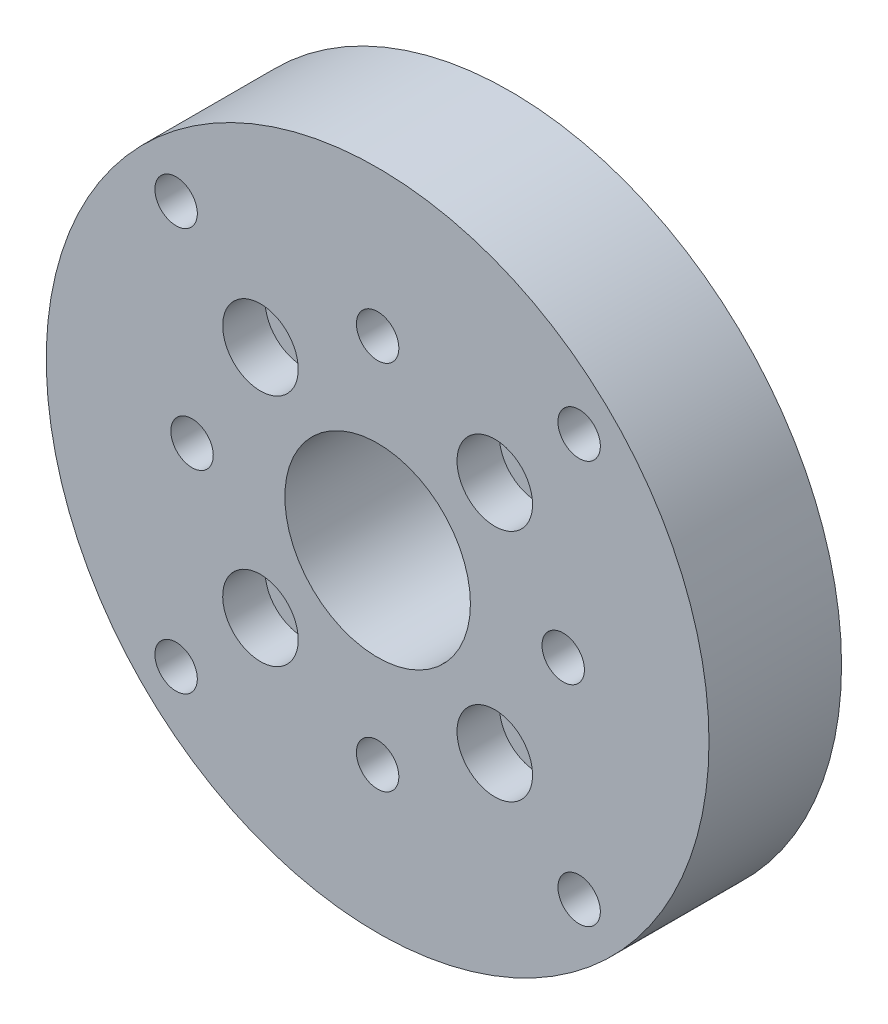
from build123d import *

# Parameters (mm, degrees)
SKETCH1_R           = 25
BOSS_EXTRUDE1_DEPTH = 10
SKETCH2_R           = 1.6
CUT_EXTRUDE1_DEPTH  = 37.742346142
SKETCH5_R           = 2.85
CUT_EXTRUDE4_DEPTH  = 3.2
CIRPATTERN1_COUNT   = 4
SKETCH8_R           = 1.6
CUT_EXTRUDE6_DEPTH  = 37.742346142
CUT_EXTRUDE2_DEPTH  = 2.6
CIRPATTERN2_COUNT   = 4
SKETCH4_R           = 7
CUT_EXTRUDE3_DEPTH  = 37.742346142
SKETCH6_R           = 1.6
CUT_EXTRUDE5_DEPTH  = 37.742346142
CIRPATTERN3_COUNT   = 4


with BuildPart() as part:
    # Sketch1 → Boss-Extrude1 (new body)
    with BuildSketch(Plane.XY):
        Circle(SKETCH1_R)
    extrude(amount=BOSS_EXTRUDE1_DEPTH)

    # Sketch2 → Cut-Extrude1 (cut, through all)
    with BuildSketch(Plane.XY.offset(10)):
        with Locations((-8.838834765, 8.838834765)):
            Circle(SKETCH2_R)
    cut_extrude1 = extrude(amount=-CUT_EXTRUDE1_DEPTH, mode=Mode.SUBTRACT)

    # Sketch5 → Cut-Extrude4 (cut)
    with BuildSketch(Plane.XY.offset(10)):
        with Locations((-8.838834765, 8.838834765)):
            Circle(SKETCH5_R)
    cut_extrude4 = extrude(amount=-CUT_EXTRUDE4_DEPTH, mode=Mode.SUBTRACT)

    # CirPattern1: Cut-Extrude1, Cut-Extrude4 ×4 about axis
    cirpattern1_axis = Axis((0, 0, 0), (0, 0, 1))
    add([cut_extrude1.rotate(cirpattern1_axis, i * 360 / CIRPATTERN1_COUNT) for i in range(1, CIRPATTERN1_COUNT)], mode=Mode.SUBTRACT)
    add([cut_extrude4.rotate(cirpattern1_axis, i * 360 / CIRPATTERN1_COUNT) for i in range(1, CIRPATTERN1_COUNT)], mode=Mode.SUBTRACT)

    # Sketch8 → Cut-Extrude6 (cut, through all)
    with BuildSketch(Plane(origin=(0, 0, 0), x_dir=(-1, 0, 0), z_dir=(0, 0, -1))):
        with Locations((0, 14)):
            Circle(SKETCH8_R)
    cut_extrude6 = extrude(amount=-CUT_EXTRUDE6_DEPTH, mode=Mode.SUBTRACT)

    # Sketch3 → Cut-Extrude2 (cut)
    with BuildSketch(Plane.XY):
        Polygon((2.85, 12.354551733), (2.85, 15.645448267), (0, 17.290896534), (-2.85, 15.645448267), (-2.85, 12.354551733), (0, 10.709103466), align=None)
    cut_extrude2 = extrude(amount=CUT_EXTRUDE2_DEPTH, mode=Mode.SUBTRACT)

    # CirPattern2: Cut-Extrude6, Cut-Extrude2 ×4 about axis
    cirpattern2_axis = Axis((0, 0, 0), (0, 0, 1))
    add([cut_extrude6.rotate(cirpattern2_axis, i * 360 / CIRPATTERN2_COUNT) for i in range(1, CIRPATTERN2_COUNT)], mode=Mode.SUBTRACT)
    add([cut_extrude2.rotate(cirpattern2_axis, i * 360 / CIRPATTERN2_COUNT) for i in range(1, CIRPATTERN2_COUNT)], mode=Mode.SUBTRACT)

    # Sketch4 → Cut-Extrude3 (cut, through all)
    with BuildSketch(Plane.XY.offset(10)):
        Circle(SKETCH4_R)
    extrude(amount=-CUT_EXTRUDE3_DEPTH, mode=Mode.SUBTRACT)

    # Sketch6 → Cut-Extrude5 (cut, through all)
    with BuildSketch(Plane(origin=(0, 0, 0), x_dir=(-1, 0, 0), z_dir=(0, 0, -1))):
        with Locations((15.202795796, 15.202795796)):
            Circle(SKETCH6_R)
    cut_extrude5 = extrude(amount=-CUT_EXTRUDE5_DEPTH, mode=Mode.SUBTRACT)

    # CirPattern3: Cut-Extrude5 ×4 about axis
    cirpattern3_axis = Axis((0, 0, 0), (0, 0, 1))
    for i in range(1, CIRPATTERN3_COUNT):
        add(cut_extrude5.rotate(cirpattern3_axis, i * 360 / CIRPATTERN3_COUNT), mode=Mode.SUBTRACT)


solid = part.part
